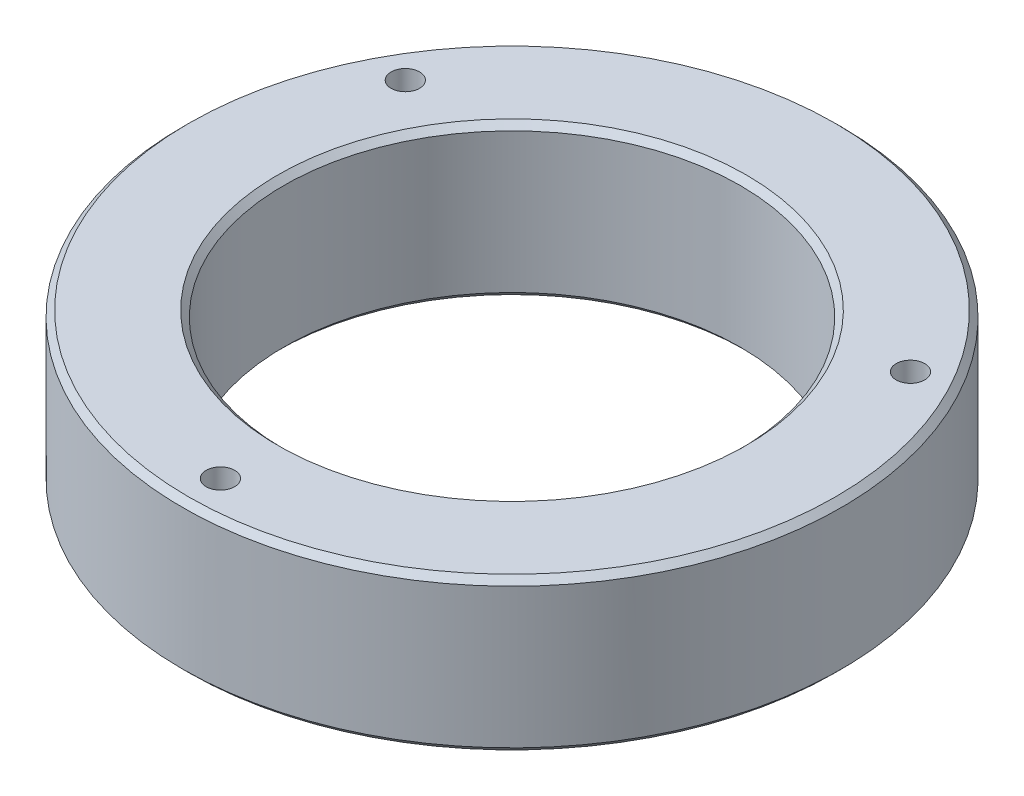
from build123d import *

# Parameters (mm, degrees)
SKETCH1_W                                        = 38.1
SKETCH1_H                                        = 25.3746
CHAMFER1_SIZE                                    = 1.524
CBORE_FOR_1_4_SOCKET_HEAD_CAP_SCREW1_D           = 7.1374
CBORE_FOR_1_4_SOCKET_HEAD_CAP_SCREW1_DEPTH       = 38.1
CBORE_FOR_1_4_SOCKET_HEAD_CAP_SCREW1_CBORE_D     = 11.1252
CBORE_FOR_1_4_SOCKET_HEAD_CAP_SCREW1_CBORE_DEPTH = 9.652
CBORE_FOR_1_4_SOCKET_HEAD_CAP_SCREW1_TIP         = 2.144291291
CUT_EXTRUDE2_START                               = -19.05
SKETCH4_R                                        = 3.96875
CUT_EXTRUDE2_DEPTH                               = 25.4


with BuildPart() as part:
    # Sketch1 → Revolve1 (revolve)
    with BuildSketch(Plane(origin=(0, 0, 0), x_dir=(0, 1, 0), z_dir=(0, 0, 1)), mode=Mode.PRIVATE) as revolve1_sk:
        with Locations((0, 69.8373)):
            Rectangle(SKETCH1_W, SKETCH1_H)
    revolve(revolve1_sk.sketch.rotate(Axis((0, -44.45, 0), (0, 1, 0)), 270), axis=Axis((0, -44.45, 0), (0, 1, 0)))

    # Chamfer1
    chamfer1_edges = [part.edges().sort_by_distance(p)[0] for p in [
        (0, -19.05, 57.15),
        (0, 19.05, 57.15),
        (0, 19.05, 82.5246),
        (0, -19.05, 82.5246),
    ]]
    chamfer(chamfer1_edges, length=CHAMFER1_SIZE)

    # CBORE for 1/4 Socket Head Cap Screw1
    with Locations(Plane(origin=(0, -19.05, 0), x_dir=(-1, 0, 0), z_dir=(0, -1, 0))):
        with Locations((0, -73.025), (-63.246, 36.5252), (63.246, 36.5252)):
            CounterBoreHole(CBORE_FOR_1_4_SOCKET_HEAD_CAP_SCREW1_D / 2, CBORE_FOR_1_4_SOCKET_HEAD_CAP_SCREW1_CBORE_D / 2, CBORE_FOR_1_4_SOCKET_HEAD_CAP_SCREW1_CBORE_DEPTH, depth=CBORE_FOR_1_4_SOCKET_HEAD_CAP_SCREW1_DEPTH)
            with Locations((0, 0, -(CBORE_FOR_1_4_SOCKET_HEAD_CAP_SCREW1_DEPTH + CBORE_FOR_1_4_SOCKET_HEAD_CAP_SCREW1_TIP / 2))):  # 118° drill point
                Cone(0, CBORE_FOR_1_4_SOCKET_HEAD_CAP_SCREW1_D / 2, CBORE_FOR_1_4_SOCKET_HEAD_CAP_SCREW1_TIP, mode=Mode.SUBTRACT)

    # Sketch4 → Cut-Extrude2 (cut)
    with BuildSketch(Plane(origin=(0, 0, 0), x_dir=(-1, 0, 0), z_dir=(0, 1, 0)).offset(CUT_EXTRUDE2_START)):
        with Locations(Location((-69.85, 0, 0), (0, 0, 90))):
            Circle(SKETCH4_R)
        with Locations(Location((69.85, 0, 0), (0, 0, 90))):
            Circle(SKETCH4_R)
    extrude(amount=CUT_EXTRUDE2_DEPTH, mode=Mode.SUBTRACT)


solid = part.part
